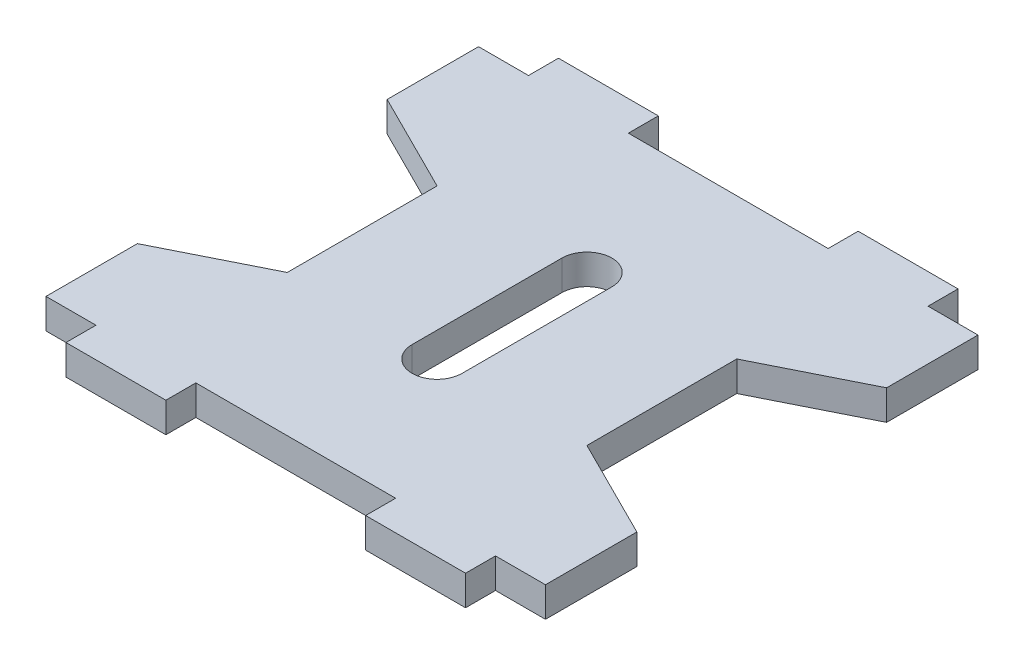
from build123d import *

# Parameters (mm, degrees)
EXTRUDE_1_DEPTH = 3


with BuildPart() as part:
    # 草图2 → 凸台-拉伸1 (new body)
    with BuildSketch(Plane(origin=(0, 0, 0), x_dir=(1, 0, 0), z_dir=(0, 1, 0))):
        Polygon((15, -7.5), (15, 7.5), (25, 12.5), (25, 21.65), (20, 21.65), (20, 24.65), (10, 24.65), (10, 21.65), (-10, 21.65), (-10, 24.65), (-20, 24.65), (-20, 21.65), (-25, 21.65), (-25, 12.5), (-15, 7.5), (-15, -7.5), (-25, -12.5), (-25, -21.65), (-20, -21.65), (-20, -24.65), (-10, -24.65), (-10, -21.65), (10, -21.65), (10, -24.65), (20, -24.65), (20, -21.65), (25, -21.65), (25, -12.5), align=None)
        with BuildLine():
            Line((-2.5, 7.5), (-2.5, -7.5))
            ThreePointArc((-2.5, -7.5), (0, -10), (2.5, -7.5))
            Line((2.5, -7.5), (2.5, 7.5))
            ThreePointArc((2.5, 7.5), (0, 10), (-2.5, 7.5))
        make_face(mode=Mode.SUBTRACT)
    extrude(amount=EXTRUDE_1_DEPTH)


solid = part.part
